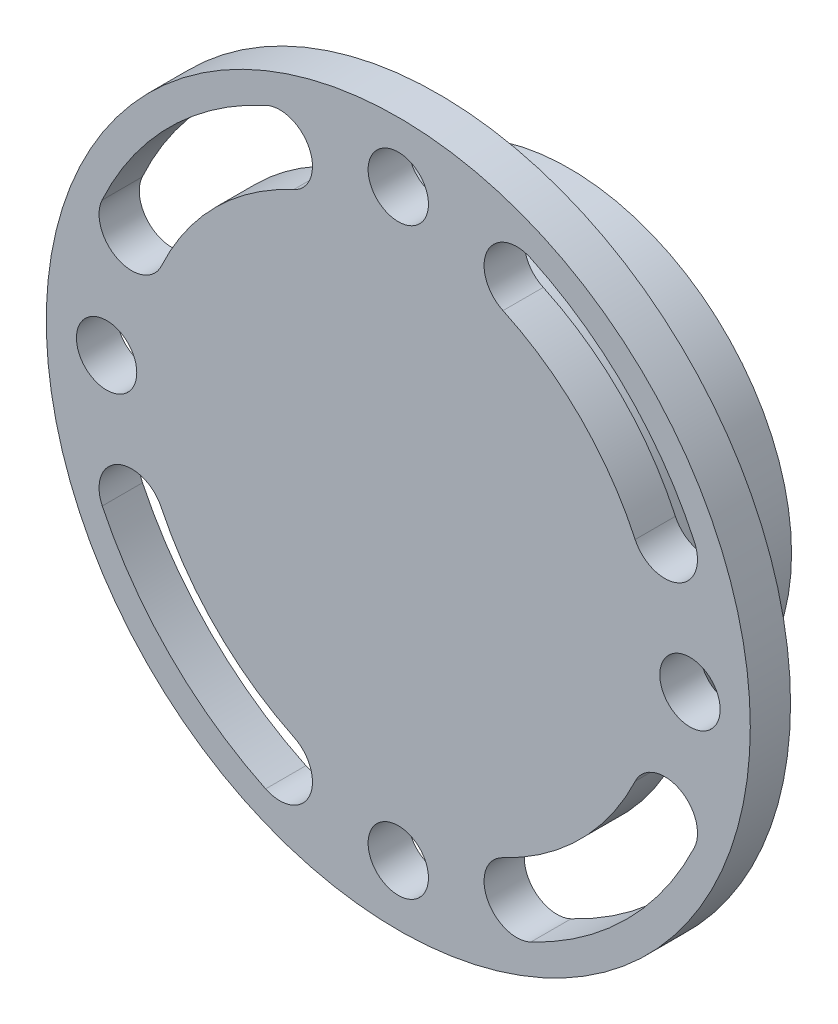
from build123d import *

# Parameters (mm, degrees)
SKETCH_1_R          = 22.1
SKETCH_1_R_2        = 20.1
EXTRUDE_1_DEPTH     = 13
SKETCH_3_R          = 35
EXTRUDE_2_DEPTH     = 4
CUT_EXTRUDE_2_DEPTH = 4
SKETCH_7_R          = 2.5
CUT_EXTRUDE_3_DEPTH = 4
SKETCH_8_R          = 3
CUT_EXTRUDE_4_DEPTH = 4


with BuildPart() as part:
    # 草图1 → 凸台-拉伸1 (new body)
    with BuildSketch(Plane.XY):
        Circle(SKETCH_1_R)
        Circle(SKETCH_1_R_2, mode=Mode.SUBTRACT)
    extrude(amount=-EXTRUDE_1_DEPTH)

    # 草图3 → 凸台-拉伸2 (add)
    with BuildSketch(Plane.XY):
        Circle(SKETCH_3_R)
    extrude(amount=EXTRUDE_2_DEPTH)

    # 草图6 → 切除-拉伸2 (cut)
    with BuildSketch(Plane.XY):
        with BuildLine():
            ThreePointArc((-13.13288474, 29.454672407), (-22.761081404, 22.761081404), (-29.454672407, 13.13288474))
            ThreePointArc((-29.454672407, 13.13288474), (-27.853665751, 8.824546582), (-23.545327593, 10.425553238))
            ThreePointArc((-23.545327593, 10.425553238), (-18.164887326, 18.164887326), (-10.425553238, 23.545327593))
            ThreePointArc((-10.425553238, 23.545327593), (-8.824546582, 27.853665751), (-13.13288474, 29.454672407))
        make_face()
        with BuildLine():
            ThreePointArc((29.448536872, 13.146197524), (22.743952769, 22.743952769), (13.146197524, 29.448536872))
            ThreePointArc((13.146197524, 29.448536872), (8.830682117, 27.866978535), (10.412240454, 23.551463128))
            ThreePointArc((10.412240454, 23.551463128), (18.147758691, 18.147758691), (23.551463128, 10.412240454))
            ThreePointArc((23.551463128, 10.412240454), (27.866978535, 8.830682117), (29.448536872, 13.146197524))
        make_face()
        with BuildLine():
            ThreePointArc((13.174546029, -29.435227837), (22.707404076, -22.707404076), (29.435227837, -13.174546029))
            ThreePointArc((29.435227837, -13.174546029), (27.895327039, -8.843991153), (23.564772163, -10.38389195))
            ThreePointArc((23.564772163, -10.38389195), (18.111209998, -18.111209998), (10.38389195, -23.564772163))
            ThreePointArc((10.38389195, -23.564772163), (8.843991153, -27.895327039), (13.174546029, -29.435227837))
        make_face()
        with BuildLine():
            ThreePointArc((-29.428635355, -13.188330396), (-22.68959412, -22.68959412), (-13.188330396, -29.428635355))
            ThreePointArc((-13.188330396, -29.428635355), (-8.850583634, -27.909111407), (-10.370107582, -23.571364645))
            ThreePointArc((-10.370107582, -23.571364645), (-18.093400043, -18.093400043), (-23.571364645, -10.370107582))
            ThreePointArc((-23.571364645, -10.370107582), (-27.909111407, -8.850583634), (-29.428635355, -13.188330396))
        make_face()
    extrude(amount=CUT_EXTRUDE_2_DEPTH, mode=Mode.SUBTRACT)

    # 草图7 → 切除-拉伸3 (cut)
    with BuildSketch(Plane(origin=(0, 0, 0), x_dir=(-1, 0, 0), z_dir=(0, 0, -1))):
        with Locations((0, 29)):
            Circle(SKETCH_7_R)
        with Locations((29, 0)):
            Circle(SKETCH_7_R)
        with Locations((0, -29)):
            Circle(SKETCH_7_R)
        with Locations((-29, 0)):
            Circle(SKETCH_7_R)
    extrude(amount=-CUT_EXTRUDE_3_DEPTH, mode=Mode.SUBTRACT)

    # 草图8 → 切除-拉伸4 (cut)
    with BuildSketch(Plane.XY):
        with Locations((0, 29)):
            Circle(SKETCH_8_R)
        with Locations((-29, 0)):
            Circle(SKETCH_8_R)
        with Locations((0, -29)):
            Circle(SKETCH_8_R)
        with Locations((29, 0)):
            Circle(SKETCH_8_R)
    extrude(amount=CUT_EXTRUDE_4_DEPTH, mode=Mode.SUBTRACT)


solid = part.part
